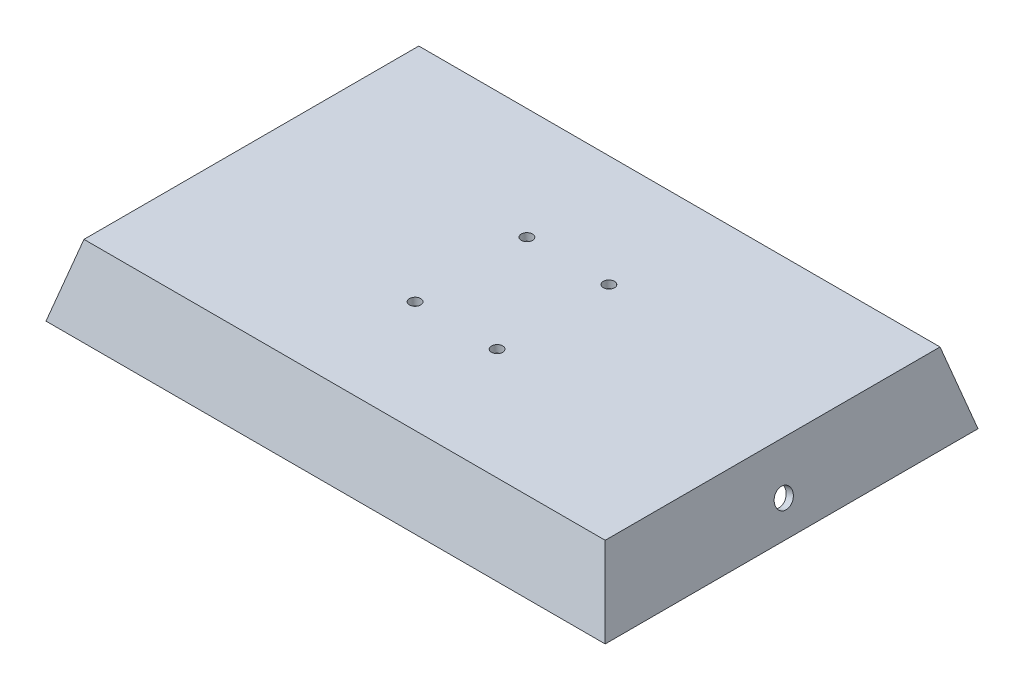
from build123d import *

# Parameters (mm, degrees)
SKETCH_4_W          = 150
SKETCH_4_H          = 100
EXTRUDE_1_DEPTH     = 19
EXTRUDE_1_TAPER     = 15
SHELL_1_T           = -2
SKETCH_13_R         = 1.5
CUT_EXTRUDE_3_DEPTH = 92.727858519
CUT_EXTRUDE_4_REACH = 94.119
SKETCH_15_R         = 3.5
SKETCH_16_R         = 2.5
CUT_EXTRUDE_5_DEPTH = 153.623831333


with BuildPart() as part:
    # 草图4 → 凸台-拉伸1 (new body)
    with BuildSketch(Plane(origin=(0, 0, 0), x_dir=(1, 0, 0), z_dir=(0, 1, 0))):
        Rectangle(SKETCH_4_W, SKETCH_4_H)
    extrude(amount=EXTRUDE_1_DEPTH, taper=EXTRUDE_1_TAPER)

    # 抽壳1
    shell_1_openings = [part.faces().sort_by_distance(p)[0] for p in [
        (0, 0, 0),
    ]]
    offset(amount=SHELL_1_T, openings=shell_1_openings, kind=Kind.INTERSECTION)

    # 草图13 → 切除-拉伸3 (cut, through all)
    with BuildSketch(Plane.XZ.offset(-17)):
        with Locations(Location((11, 15, 0), (0, 0, 270))):
            Circle(SKETCH_13_R)
        with Locations(Location((-11, 15, 0), (0, 0, 90))):
            Circle(SKETCH_13_R)
        with Locations(Location((11, -15, 0), (0, 0, 90))):
            Circle(SKETCH_13_R)
        with Locations(Location((-11, -15, 0), (0, 0, 270))):
            Circle(SKETCH_13_R)
    extrude(amount=-CUT_EXTRUDE_3_DEPTH, mode=Mode.SUBTRACT)

    # 切除-拉伸4: up to this plane
    cut_extrude_4_end = Plane(origin=(-75, 0, 50), z_dir=(-0.9659258262890681, 0.2588190451025214, 0))
    # 草图15 → 切除-拉伸4 (cut, up to the surface)
    with BuildSketch(Plane(origin=(0, 0, 0), x_dir=(0, 0, -1), z_dir=(1, 0, 0)), mode=Mode.PRIVATE) as cut_extrude_4_sk1:
        with Locations(Location((-35, 9.5, 0), (0, 0, 90))):
            Circle(SKETCH_15_R)
    cut_extrude_4_tool1 = split(extrude(cut_extrude_4_sk1.sketch, amount=-CUT_EXTRUDE_4_REACH, mode=Mode.PRIVATE), bisect_by=cut_extrude_4_end, keep=Keep.BOTH, mode=Mode.PRIVATE)
    add(cut_extrude_4_tool1.solids().sort_by_distance((0, 9.5, 35))[0], mode=Mode.SUBTRACT)
    # 草图15 → 切除-拉伸4 (cut, up to the surface)
    with BuildSketch(Plane(origin=(0, 0, 0), x_dir=(0, 0, -1), z_dir=(1, 0, 0)), mode=Mode.PRIVATE) as cut_extrude_4_sk2:
        with Locations(Location((35, 9.5, 0), (0, 0, 90))):
            Circle(SKETCH_15_R)
    cut_extrude_4_tool2 = split(extrude(cut_extrude_4_sk2.sketch, amount=-CUT_EXTRUDE_4_REACH, mode=Mode.PRIVATE), bisect_by=cut_extrude_4_end, keep=Keep.BOTH, mode=Mode.PRIVATE)
    add(cut_extrude_4_tool2.solids().sort_by_distance((0, 9.5, -35))[0], mode=Mode.SUBTRACT)

    # 草图16 → 切除-拉伸5 (cut, through all)
    with BuildSketch(Plane(origin=(68.044100989, 18.23236191, 0), x_dir=(0, 0, 1), z_dir=(-0.9659258262890681, -0.2588190451025214, 0))):
        with Locations(Location((0, -11.275834931, 0), (0, 0, 270))):
            Circle(SKETCH_16_R)
    extrude(amount=-CUT_EXTRUDE_5_DEPTH, mode=Mode.SUBTRACT)


solid = part.part
